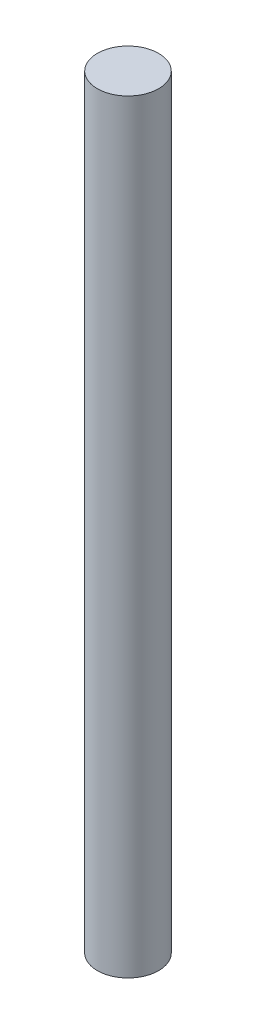
from build123d import *

# Parameters (mm, degrees)
SKETCH2_R           = 1.985
BOSS_EXTRUDE1_DEPTH = 49.5


with BuildPart() as part:
    # Sketch2 → Boss-Extrude1 (new body)
    with BuildSketch(Plane(origin=(0, 0, 0), x_dir=(1, 0, 0), z_dir=(0, 1, 0))):
        with Locations(Location((0, 0, 0), (0, 0, 270))):
            Circle(SKETCH2_R)
    extrude(amount=BOSS_EXTRUDE1_DEPTH)


solid = part.part
